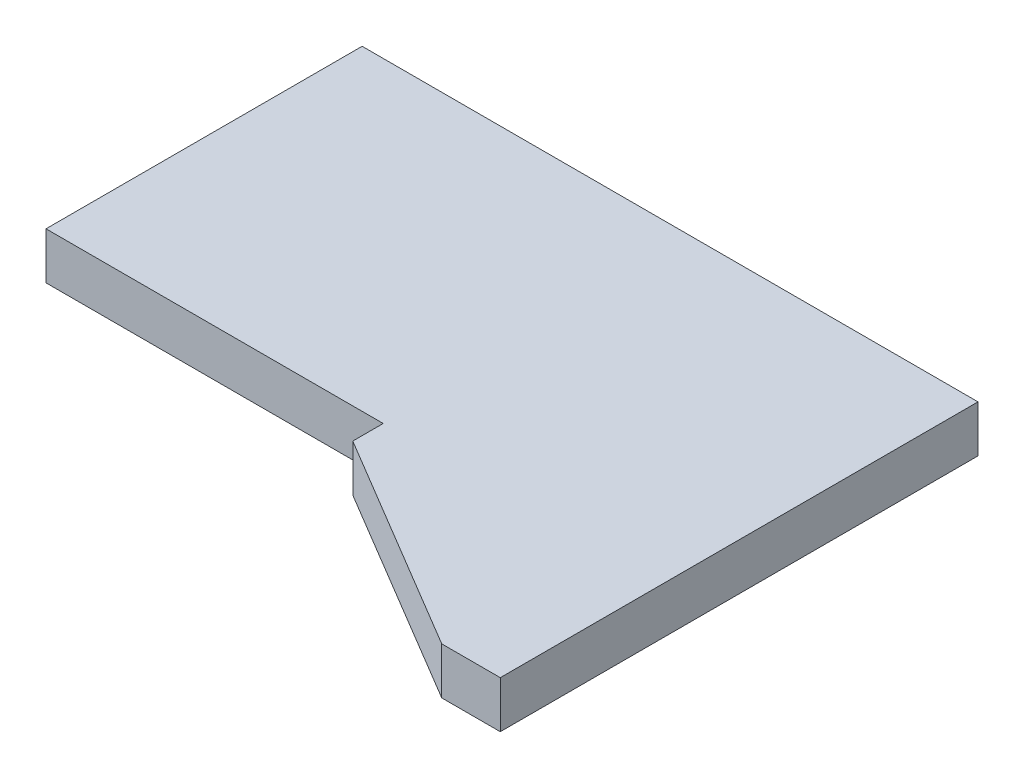
from build123d import *

# Parameters (mm, degrees)
BOSS_EXTRUDE1_DEPTH = 10


with BuildPart() as part:
    # PCB → Boss-Extrude1 (new body)
    with BuildSketch(Plane(origin=(0, 0, 0), x_dir=(1, 0, 0), z_dir=(0, 1, 0))):
        Polygon((0, 0), (131.5, 0), (131.5, -102), (119, -102), (72, -74), (72, -67.5), (0, -67.5), align=None)
    extrude(amount=BOSS_EXTRUDE1_DEPTH)


solid = part.part
